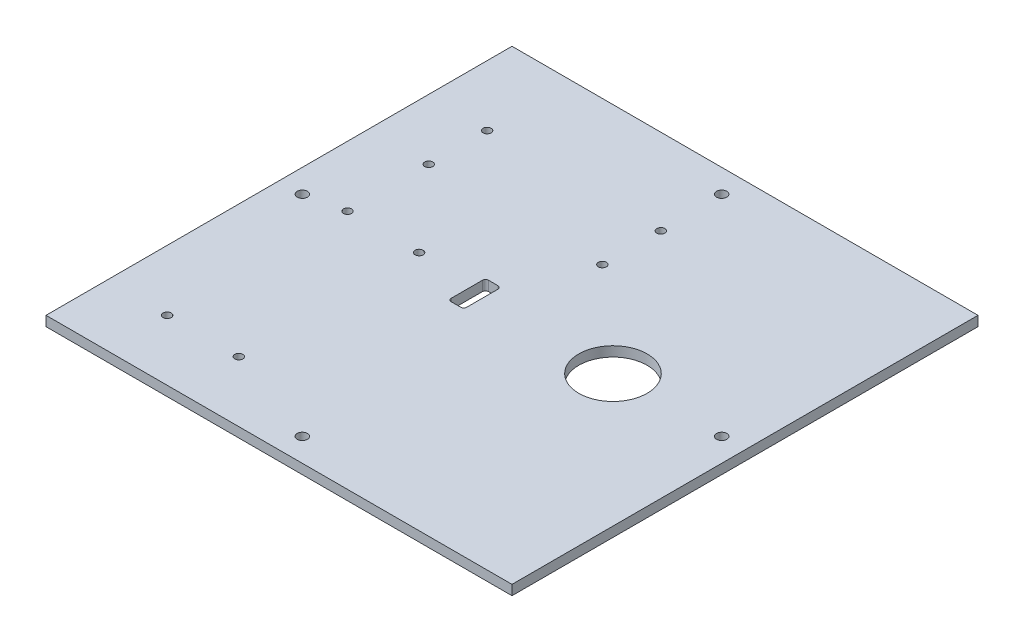
from build123d import *

# Parameters (mm, degrees)
SKETCH1_W           = 150
SKETCH1_H           = 150
SKETCH1_R           = 1.65
SKETCH1_R_2         = 1.3
SKETCH1_R_3         = 11
BOSS_EXTRUDE1_DEPTH = 3.175


with BuildPart() as part:
    # Sketch1 → Boss-Extrude1 (new body)
    with BuildSketch(Plane(origin=(0, 0, 0), x_dir=(1, 0, 0), z_dir=(0, 1, 0))):
        Rectangle(SKETCH1_W, SKETCH1_H)
        with Locations(Location((-67.5, 0, 0), (0, 0, 270))):
            Circle(SKETCH1_R, mode=Mode.SUBTRACT)
        with Locations(Location((0, 67.5, 0), (0, 0, 270))):
            Circle(SKETCH1_R, mode=Mode.SUBTRACT)
        with Locations(Location((67.5, 0, 0), (0, 0, 270))):
            Circle(SKETCH1_R, mode=Mode.SUBTRACT)
        with Locations(Location((0, -67.5, 0), (0, 0, 270))):
            Circle(SKETCH1_R, mode=Mode.SUBTRACT)
        with Locations(Location((-55.5, -55.5, 0), (0, 0, 270))):
            Circle(SKETCH1_R_2, mode=Mode.SUBTRACT)
        with Locations(Location((-32.45, -55.5, 0), (0, 0, 270))):
            Circle(SKETCH1_R_2, mode=Mode.SUBTRACT)
        with Locations(Location((-32.45, 2.55, 0), (0, 0, 270))):
            Circle(SKETCH1_R_2, mode=Mode.SUBTRACT)
        with Locations(Location((-55.5, 2.55, 0), (0, 0, 270))):
            Circle(SKETCH1_R_2, mode=Mode.SUBTRACT)
        with Locations(Location((0.4, 47.5, 0), (0, 0, 270))):
            Circle(SKETCH1_R_2, mode=Mode.SUBTRACT)
        with Locations(Location((0.4, 28.7, 0), (0, 0, 270))):
            Circle(SKETCH1_R_2, mode=Mode.SUBTRACT)
        with Locations(Location((-55.5, 47.5, 0), (0, 0, 270))):
            Circle(SKETCH1_R_2, mode=Mode.SUBTRACT)
        with Locations(Location((-55.5, 28.7, 0), (0, 0, 270))):
            Circle(SKETCH1_R_2, mode=Mode.SUBTRACT)
        with Locations(Location((32.5, 0, 0), (0, 0, 270))):
            Circle(SKETCH1_R_3, mode=Mode.SUBTRACT)
        with BuildLine():
            Line((-13.534289991, -6), (-10.534289991, -6))
            ThreePointArc((-10.534289991, -6), (-9.82718321, -5.707106781), (-9.534289991, -5))
            Line((-9.534289991, -5), (-9.534289991, 5))
            ThreePointArc((-9.534289991, 5), (-9.82718321, 5.707106781), (-10.534289991, 6))
            Line((-10.534289991, 6), (-13.534289991, 6))
            ThreePointArc((-13.534289991, 6), (-14.241396772, 5.707106781), (-14.534289991, 5))
            Line((-14.534289991, 5), (-14.534289991, -5))
            ThreePointArc((-14.534289991, -5), (-14.241396772, -5.707106781), (-13.534289991, -6))
        make_face(mode=Mode.SUBTRACT)
    extrude(amount=BOSS_EXTRUDE1_DEPTH)


solid = part.part
